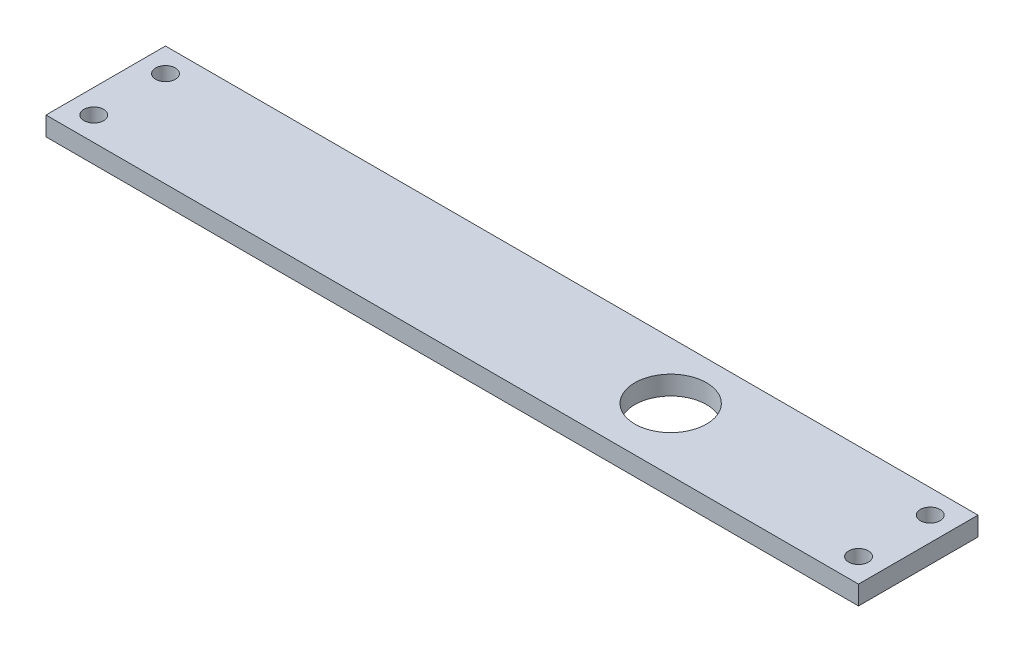
from build123d import *

# Parameters (mm, degrees)
SKETCH1_W           = 136
SKETCH1_H           = 20
SKETCH1_R           = 1.65
SKETCH1_R_2         = 6
BOSS_EXTRUDE1_DEPTH = 3.175


with BuildPart() as part:
    # Sketch1 → Boss-Extrude1 (new body)
    with BuildSketch(Plane(origin=(0, 0, 0), x_dir=(1, 0, 0), z_dir=(0, 1, 0))):
        with Locations((68, -10)):
            Rectangle(SKETCH1_W, SKETCH1_H)
        with Locations(Location((4, -4, 0), (0, 0, 270))):
            Circle(SKETCH1_R, mode=Mode.SUBTRACT)
        with Locations(Location((132, -4, 0), (0, 0, 270))):
            Circle(SKETCH1_R, mode=Mode.SUBTRACT)
        with Locations(Location((94.08554011, -9.52416591, 0), (0, 0, 270))):
            Circle(SKETCH1_R_2, mode=Mode.SUBTRACT)
        with Locations(Location((4, -16, 0), (0, 0, 270))):
            Circle(SKETCH1_R, mode=Mode.SUBTRACT)
        with Locations(Location((132, -16, 0), (0, 0, 270))):
            Circle(SKETCH1_R, mode=Mode.SUBTRACT)
    extrude(amount=BOSS_EXTRUDE1_DEPTH)


solid = part.part
